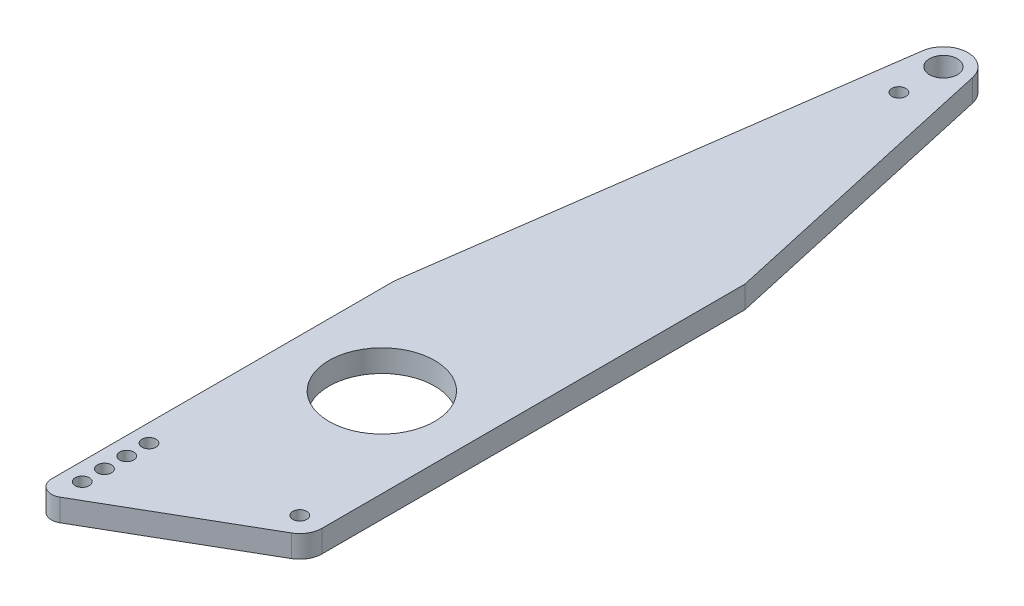
from build123d import *

# Parameters (mm, degrees)
SKETCH1_R           = 3.96875
SKETCH1_R_2         = 15.08125
SKETCH1_R_3         = 2
BOSS_EXTRUDE1_DEPTH = 6.35


with BuildPart() as part:
    # Sketch1 → Boss-Extrude1 (new body)
    with BuildSketch(Plane(origin=(0, 0, 0), x_dir=(1, 0, 0), z_dir=(0, 1, 0))):
        with BuildLine():
            Line((25.4, -82.038158574), (25.4, -202.708825791))
            ThreePointArc((25.4, -202.708825791), (24.549261314, -205.883825791), (22.225, -208.208087105))
            Line((22.225, -208.208087105), (-19.685, -232.404836886))
            ThreePointArc((-19.685, -232.404836886), (-23.495, -232.404836886), (-25.4, -229.105280098))
            Line((-25.4, -229.105280098), (-25.4, -131.278691098))
            Line((-25.4, -131.278691098), (-6.917767735, 0.966806375))
            ThreePointArc((-6.917767735, 0.966806375), (-0.279220673, 6.97941694), (6.818426198, 1.51634072))
            Line((6.818426198, 1.51634072), (25.4, -82.038158574))
        make_face()
        with Locations(Location((0, 0, 0), (0, 0, 270))):
            Circle(SKETCH1_R, mode=Mode.SUBTRACT)
        with Locations(Location((0, -160.246508934, 0), (0, 0, 270))):
            Circle(SKETCH1_R_2, mode=Mode.SUBTRACT)
        with Locations(Location((-20.32, -225.425, 0), (0, 0, 270))):
            Circle(SKETCH1_R_3, mode=Mode.SUBTRACT)
        with Locations(Location((-20.32, -219.075, 0), (0, 0, 270))):
            Circle(SKETCH1_R_3, mode=Mode.SUBTRACT)
        with Locations(Location((-20.32, -212.725, 0), (0, 0, 270))):
            Circle(SKETCH1_R_3, mode=Mode.SUBTRACT)
        with Locations(Location((-20.32, -206.375, 0), (0, 0, 270))):
            Circle(SKETCH1_R_3, mode=Mode.SUBTRACT)
        with Locations(Location((0, -12.7, 0), (0, 0, 270))):
            Circle(SKETCH1_R_3, mode=Mode.SUBTRACT)
        with Locations(Location((19.05, -202.708825791, 0), (0, 0, 270))):
            Circle(SKETCH1_R_3, mode=Mode.SUBTRACT)
    extrude(amount=-BOSS_EXTRUDE1_DEPTH)


solid = part.part
